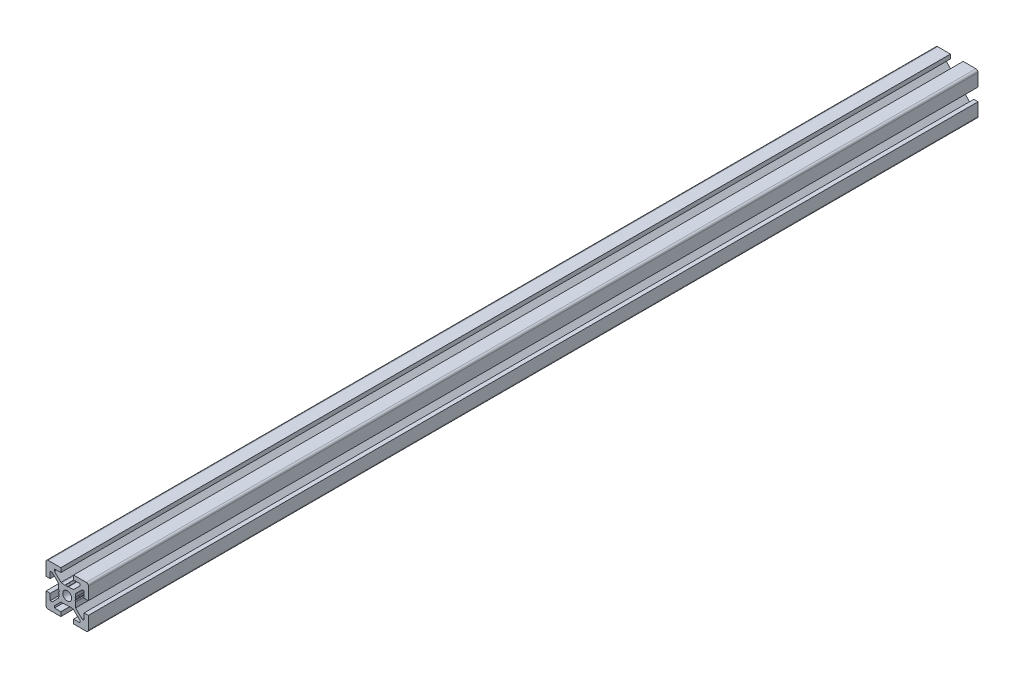
from build123d import *

# Parameters (mm, degrees)
SKETCH1_R           = 2.1
BOSS_EXTRUDE1_DEPTH = 420


with BuildPart() as part:
    # Sketch1 → Boss-Extrude1 (new body)
    with BuildSketch(Plane(origin=(0, 0, -2000), x_dir=(-1, 0, 0), z_dir=(0, 0, -1))):
        with BuildLine():
            Line((10, -3), (8, -3))
            Line((8, -3), (8, -6))
            Line((8, -6), (7.060660172, -6))
            Line((7.060660172, -6), (4, -2.939339828))
            Line((4, -2.939339828), (4, -2.5))
            Line((4, -2.5), (3.750976592, -1.218885629))
            Line((3.750976592, -1.218885629), (3.933012702, -0.903589838))
            ThreePointArc((3.933012702, -0.903589838), (4, -0.653589838), (3.933012702, -0.403589838))
            Line((3.933012702, -0.403589838), (3.7, 0))
            Line((3.7, 0), (3.933012702, 0.403589838))
            ThreePointArc((3.933012702, 0.403589838), (3.982962913, 0.524180316), (4, 0.653589838))
            Line((4, 0.653589838), (4, 2.939339828))
            Line((4, 2.939339828), (7.060660172, 6))
            Line((7.060660172, 6), (8, 6))
            Line((8, 6), (8, 3))
            Line((8, 3), (10, 3))
            Line((10, 3), (10, 9))
            ThreePointArc((10, 9), (9.707106781, 9.707106781), (9, 10))
            Line((9, 10), (3, 10))
            Line((3, 10), (3, 8))
            Line((3, 8), (6, 8))
            Line((6, 8), (6, 7.060660172))
            Line((6, 7.060660172), (2.939339828, 4))
            Line((2.939339828, 4), (2.5, 4))
            Line((2.5, 4), (1.218885629, 3.750976592))
            Line((1.218885629, 3.750976592), (0.903589838, 3.933012702))
            ThreePointArc((0.903589838, 3.933012702), (0.653589838, 4), (0.403589838, 3.933012702))
            Line((0.403589838, 3.933012702), (0, 3.7))
            Line((0, 3.7), (-0.403589838, 3.933012702))
            ThreePointArc((-0.403589838, 3.933012702), (-0.524180316, 3.982962913), (-0.653589838, 4))
            Line((-0.653589838, 4), (-2.939339828, 4))
            Line((-2.939339828, 4), (-6, 7.060660172))
            Line((-6, 7.060660172), (-6, 8))
            Line((-6, 8), (-3, 8))
            Line((-3, 8), (-3, 10))
            Line((-3, 10), (-9, 10))
            ThreePointArc((-9, 10), (-9.707106781, 9.707106781), (-10, 9))
            Line((-10, 9), (-10, 3))
            Line((-10, 3), (-8, 3))
            Line((-8, 3), (-8, 6))
            Line((-8, 6), (-7.060660172, 6))
            Line((-7.060660172, 6), (-4, 2.939339828))
            Line((-4, 2.939339828), (-4, 2.5))
            Line((-4, 2.5), (-3.750976592, 1.218885629))
            Line((-3.750976592, 1.218885629), (-3.933012702, 0.903589838))
            ThreePointArc((-3.933012702, 0.903589838), (-4, 0.653589838), (-3.933012702, 0.403589838))
            Line((-3.933012702, 0.403589838), (-3.7, 0))
            Line((-3.7, 0), (-3.933012702, -0.403589838))
            ThreePointArc((-3.933012702, -0.403589838), (-3.982962913, -0.524180316), (-4, -0.653589838))
            Line((-4, -0.653589838), (-4, -2.939339828))
            Line((-4, -2.939339828), (-7.060660172, -6))
            Line((-7.060660172, -6), (-8, -6))
            Line((-8, -6), (-8, -3))
            Line((-8, -3), (-10, -3))
            Line((-10, -3), (-10, -9))
            ThreePointArc((-10, -9), (-9.707106781, -9.707106781), (-9, -10))
            Line((-9, -10), (-3, -10))
            Line((-3, -10), (-3, -8))
            Line((-3, -8), (-6, -8))
            Line((-6, -8), (-6, -7.060660172))
            Line((-6, -7.060660172), (-2.939339828, -4))
            Line((-2.939339828, -4), (-2.5, -4))
            Line((-2.5, -4), (-1.218885629, -3.750976592))
            Line((-1.218885629, -3.750976592), (-0.903589838, -3.933012702))
            ThreePointArc((-0.903589838, -3.933012702), (-0.653589838, -4), (-0.403589838, -3.933012702))
            Line((-0.403589838, -3.933012702), (0, -3.7))
            Line((0, -3.7), (0.403589838, -3.933012702))
            ThreePointArc((0.403589838, -3.933012702), (0.524180316, -3.982962913), (0.653589838, -4))
            Line((0.653589838, -4), (2.939339828, -4))
            Line((2.939339828, -4), (6, -7.060660172))
            Line((6, -7.060660172), (6, -8))
            Line((6, -8), (3, -8))
            Line((3, -8), (3, -10))
            Line((3, -10), (9, -10))
            ThreePointArc((9, -10), (9.707106781, -9.707106781), (10, -9))
            Line((10, -9), (10, -3))
        make_face()
        with Locations(Location((0, 0, 0), (0, 0, 180))):
            Circle(SKETCH1_R, mode=Mode.SUBTRACT)
    extrude(amount=-BOSS_EXTRUDE1_DEPTH)


solid = part.part
